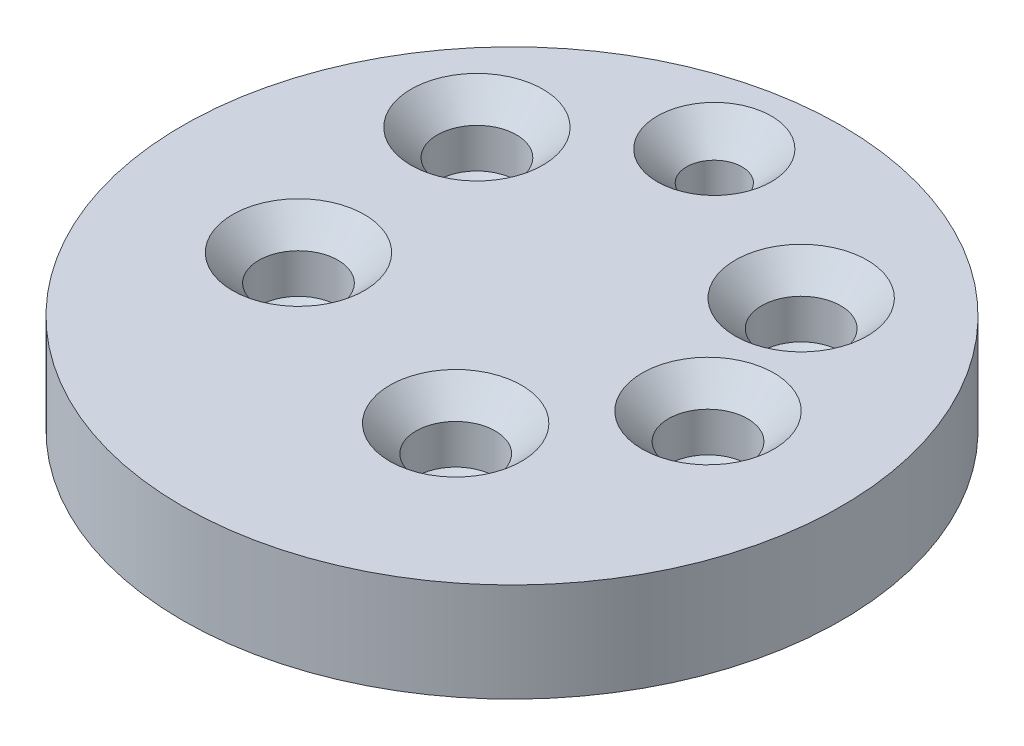
from build123d import *

# Parameters (mm, degrees)
SKETCH1_R                                            = 50
BOSS_EXTRUDE1_DEPTH                                  = 15
CSK_FOR_M10_COUNTERSUNK_FLAT_HEAD_SCREW2_D           = 12
CSK_FOR_M10_COUNTERSUNK_FLAT_HEAD_SCREW2_DEPTH       = 10
CSK_FOR_M10_COUNTERSUNK_FLAT_HEAD_SCREW2_CSINK_D     = 20
CSK_FOR_M10_COUNTERSUNK_FLAT_HEAD_SCREW2_CSINK_ANGLE = 90
CSK_FOR_M10_COUNTERSUNK_FLAT_HEAD_SCREW2_TIP         = 3.605163714
CSK_FOR_M8_COUNTERSUNK_FLAT_HEAD_SCREW1_D            = 8.4
CSK_FOR_M8_COUNTERSUNK_FLAT_HEAD_SCREW1_DEPTH        = 10
CSK_FOR_M8_COUNTERSUNK_FLAT_HEAD_SCREW1_CSINK_D      = 17.3
CSK_FOR_M8_COUNTERSUNK_FLAT_HEAD_SCREW1_CSINK_ANGLE  = 90
CSK_FOR_M8_COUNTERSUNK_FLAT_HEAD_SCREW1_TIP          = 2.5236146


with BuildPart() as part:
    # Sketch1 → Boss-Extrude1 (new body)
    with BuildSketch(Plane(origin=(0, 0, 0), x_dir=(1, 0, 0), z_dir=(0, 1, 0))):
        with Locations(Location((0, 0, 0), (0, 0, 270))):
            Circle(SKETCH1_R)
    extrude(amount=BOSS_EXTRUDE1_DEPTH)

    # CSK for M10 Countersunk Flat Head Screw2
    with Locations(Plane(origin=(0, 15, 0), x_dir=(1, 0, 0), z_dir=(0, 1, 0))):
        with Locations((-27.458630514, 22.136146371), (19.59369175, 24.281141581), (-24.521924649, -7.872760418), (9.832439438, -18.376753366), (27.367685205, 2.373094983)):
            CounterSinkHole(CSK_FOR_M10_COUNTERSUNK_FLAT_HEAD_SCREW2_D / 2, CSK_FOR_M10_COUNTERSUNK_FLAT_HEAD_SCREW2_CSINK_D / 2, depth=CSK_FOR_M10_COUNTERSUNK_FLAT_HEAD_SCREW2_DEPTH, counter_sink_angle=CSK_FOR_M10_COUNTERSUNK_FLAT_HEAD_SCREW2_CSINK_ANGLE)
            with Locations((0, 0, -(CSK_FOR_M10_COUNTERSUNK_FLAT_HEAD_SCREW2_DEPTH + CSK_FOR_M10_COUNTERSUNK_FLAT_HEAD_SCREW2_TIP / 2))):  # 118° drill point
                Cone(0, CSK_FOR_M10_COUNTERSUNK_FLAT_HEAD_SCREW2_D / 2, CSK_FOR_M10_COUNTERSUNK_FLAT_HEAD_SCREW2_TIP, mode=Mode.SUBTRACT)

    # CSK for M8 Countersunk Flat Head Screw1
    with Locations(Plane(origin=(0, 15, 0), x_dir=(1, 0, 0), z_dir=(0, 1, 0))):
        with Locations((-6.596639158, 37.29118486)):
            CounterSinkHole(CSK_FOR_M8_COUNTERSUNK_FLAT_HEAD_SCREW1_D / 2, CSK_FOR_M8_COUNTERSUNK_FLAT_HEAD_SCREW1_CSINK_D / 2, depth=CSK_FOR_M8_COUNTERSUNK_FLAT_HEAD_SCREW1_DEPTH, counter_sink_angle=CSK_FOR_M8_COUNTERSUNK_FLAT_HEAD_SCREW1_CSINK_ANGLE)
            with Locations((0, 0, -(CSK_FOR_M8_COUNTERSUNK_FLAT_HEAD_SCREW1_DEPTH + CSK_FOR_M8_COUNTERSUNK_FLAT_HEAD_SCREW1_TIP / 2))):  # 118° drill point
                Cone(0, CSK_FOR_M8_COUNTERSUNK_FLAT_HEAD_SCREW1_D / 2, CSK_FOR_M8_COUNTERSUNK_FLAT_HEAD_SCREW1_TIP, mode=Mode.SUBTRACT)


solid = part.part
